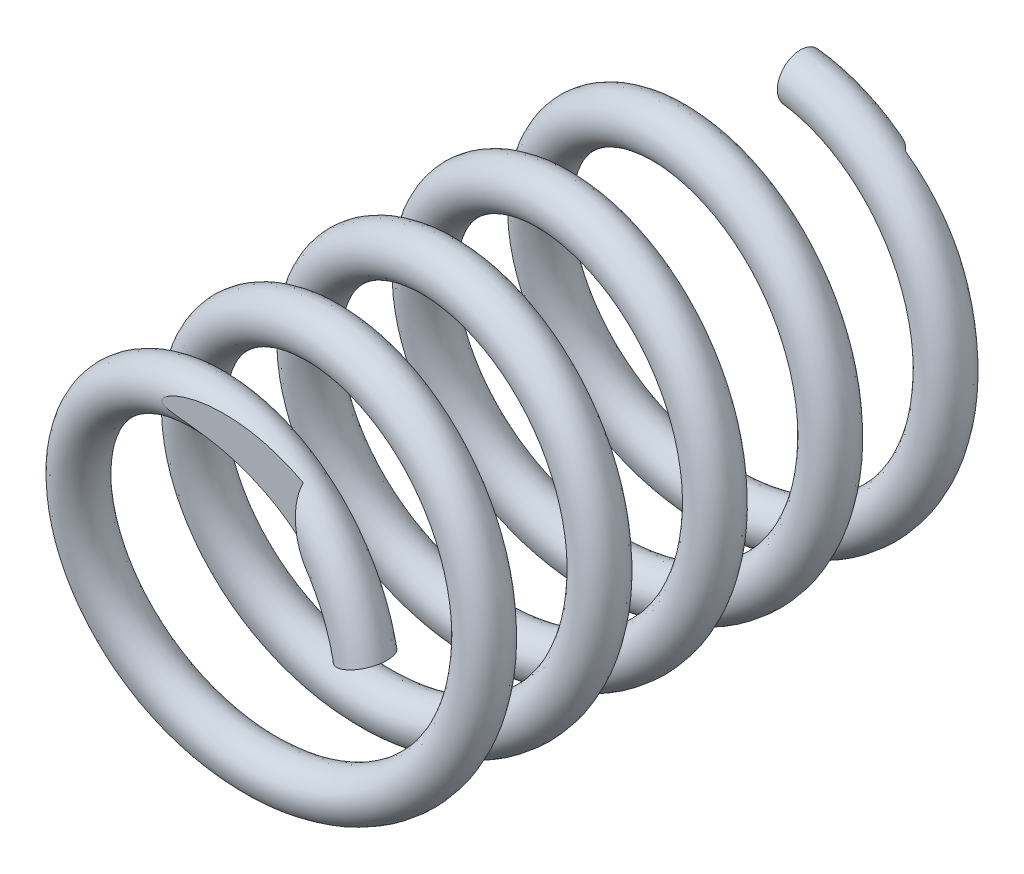
from build123d import *

# Parameters (mm, degrees)
SWEEP2_PITCH            = 25
SWEEP2_HEIGHT           = 130
SWEEP2_RADIUS           = 37.5
SWEEP2_START_ANGLE      = 90
SKETCH4_R               = 5
CUT_EXTRUDE1_DEPTH      = 150.843140206
CUT_EXTRUDE1_DEPTH_BACK = 150.843140206
SKETCH9_W               = 9.218257816
SKETCH9_H               = 36.154820683
CUT_EXTRUDE2_DEPTH      = 153.617146445
CUT_EXTRUDE2_DEPTH_BACK = 153.617146445
SKETCH10_W              = 32.861999259
SKETCH10_H              = 9.094649242


with BuildPart() as part:
    # Sweep2: sweep along a helix
    with BuildLine() as sweep2_path:
        add(Helix(SWEEP2_PITCH, SWEEP2_HEIGHT, SWEEP2_RADIUS, center=(15, -6.710931412, 0), direction=(0, 0, 1), lefthand=True, mode=Mode.PRIVATE).rotate(Axis((15, -6.710931412, 0), (0, 0, 1)), SWEEP2_START_ANGLE))
    # Sketch4 → Sweep2 (sweep)
    with BuildSketch(Plane(origin=(15, 0, 0), x_dir=(0, 0, -1), z_dir=(1, 0, 0))):
        with Locations((0, 30.789068588)):
            Circle(SKETCH4_R)
    sweep(path=sweep2_path.line, is_frenet=True)

    # Sketch9 → Cut-Extrude1 (cut, two sides: drawn at the far end of the back side and taken through both)
    with BuildSketch(Plane.ZY.offset(-15).offset(-CUT_EXTRUDE1_DEPTH_BACK)):
        with Locations((-4.317980465, 10.415347062)):
            Rectangle(SKETCH9_W, SKETCH9_H)
    extrude(amount=CUT_EXTRUDE1_DEPTH + CUT_EXTRUDE1_DEPTH_BACK, mode=Mode.SUBTRACT)

    # Sketch10 → Cut-Extrude2 (cut, two sides: drawn at the far end of the back side and taken through both)
    with BuildSketch(Plane(origin=(3.404650943, -10.478475337, 0), x_dir=(0.9510568385477239, 0.30901600258175715, 0), z_dir=(0.30901600258175715, -0.9510568385477239, 0)).offset(-CUT_EXTRUDE2_DEPTH_BACK)):
        with Locations((27.227882757, 133.541171462)):
            Rectangle(SKETCH10_W, SKETCH10_H)
    extrude(amount=CUT_EXTRUDE2_DEPTH + CUT_EXTRUDE2_DEPTH_BACK, mode=Mode.SUBTRACT)


solid = part.part
